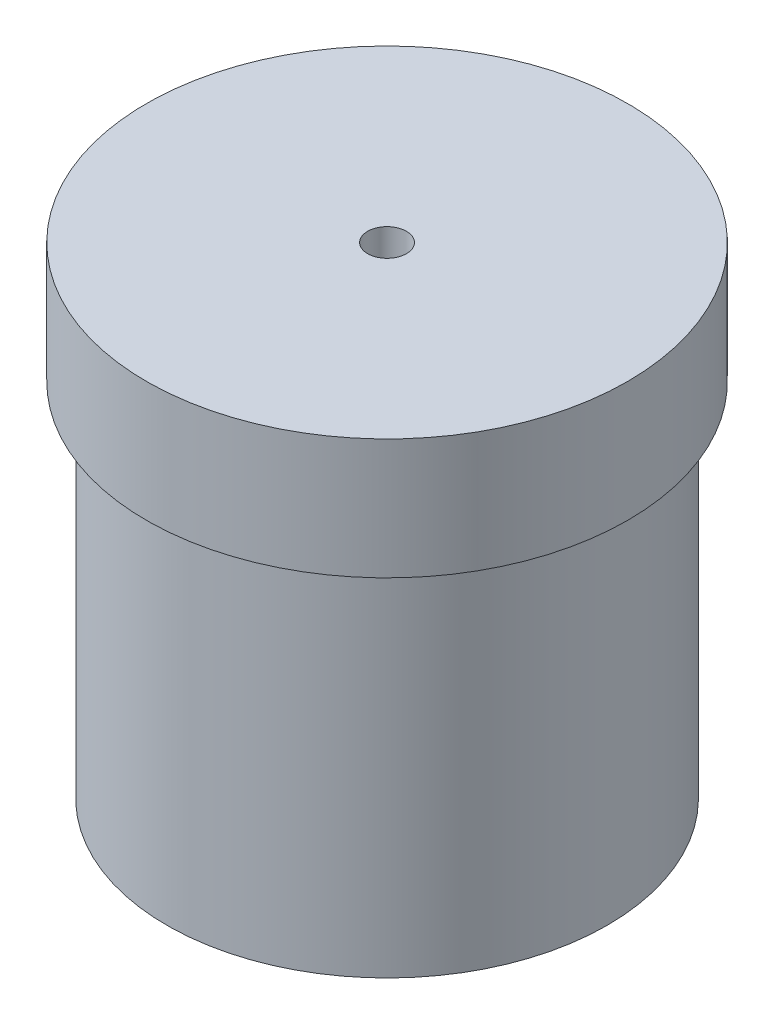
from build123d import *

# Parameters (mm, degrees)
M2_5X0_45_TAPPED_HOLE1_D     = 2.05
M2_5X0_45_TAPPED_HOLE1_DEPTH = 6.35
M2_5X0_45_TAPPED_HOLE1_TIP   = 0.615882135


with BuildPart() as part:
    # Sketch1 → Revolve1 (revolve)
    with BuildSketch(Plane.XY, mode=Mode.PRIVATE) as revolve1_sk:
        Polygon((0, 12.7), (-12.7, 12.7), (-12.7, 6.35), (-11.6205, 6.35), (-11.6205, -12.7), (0, -12.7), align=None)
    revolve(revolve1_sk.sketch.rotate(Axis((0, -12.7, 0), (0, 1, 0)), 180), axis=Axis((0, -12.7, 0), (0, 1, 0)))

    # M2.5x0.45 Tapped Hole1
    with Locations(Plane(origin=(0, 12.7, 0), x_dir=(1, 0, 0), z_dir=(0, 1, 0))):
        with Locations((0, 0)):
            Hole(M2_5X0_45_TAPPED_HOLE1_D / 2, depth=M2_5X0_45_TAPPED_HOLE1_DEPTH)
            with Locations((0, 0, -(M2_5X0_45_TAPPED_HOLE1_DEPTH + M2_5X0_45_TAPPED_HOLE1_TIP / 2))):  # 118° drill point
                Cone(0, M2_5X0_45_TAPPED_HOLE1_D / 2, M2_5X0_45_TAPPED_HOLE1_TIP, mode=Mode.SUBTRACT)


solid = part.part
